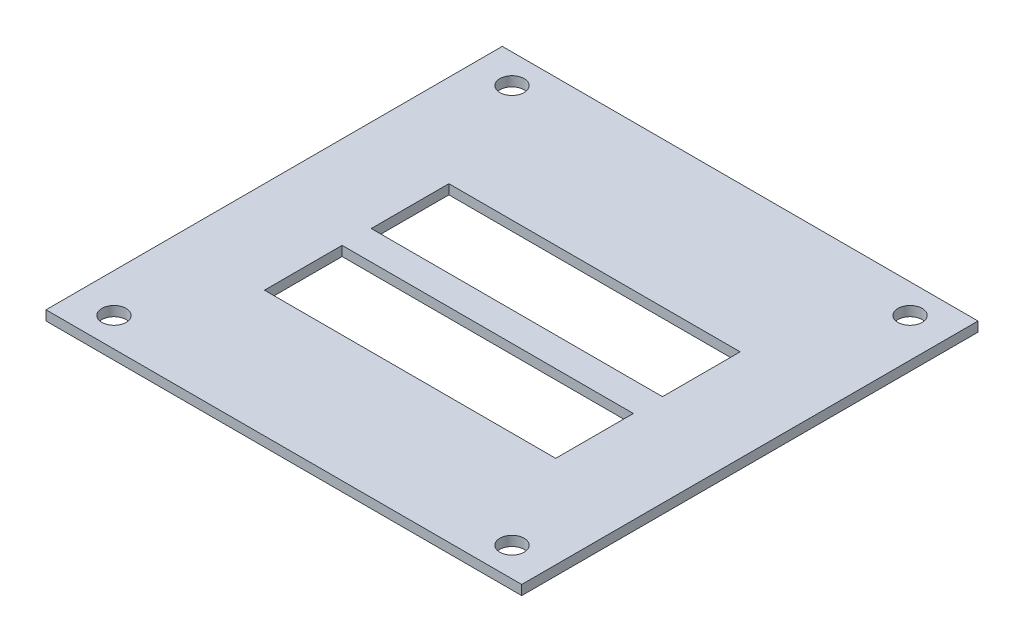
from build123d import *

# Parameters (mm, degrees)
CROQUIS1_W                                 = 49
CROQUIS1_H                                 = 47
SALIENTE_EXTRUIR1_DEPTH                    = 1
PERFORADOR_PARA_ROSCAR_PARA_MACHO_DE_ROS_D = 2.5
CORTAR_EXTRUIR1_REACH                      = 69.904
CROQUIS5_W                                 = 30
CROQUIS5_H                                 = 8


with BuildPart() as part:
    # Croquis1 → Saliente-Extruir1 (new body)
    with BuildSketch(Plane(origin=(0, 0, 0), x_dir=(1, 0, 0), z_dir=(0, 1, 0))):
        with Locations((24.5, 23.5)):
            Rectangle(CROQUIS1_W, CROQUIS1_H)
    extrude(amount=SALIENTE_EXTRUIR1_DEPTH)

    # Perforador para roscar para macho de roscar para M31 (through all)
    with Locations(Plane(origin=(4, 1, -44), x_dir=(0, 0, 1), z_dir=(0, 1, 0))):
        with Locations((0, 0), (41, 0), (41, 41), (0, 41)):
            Hole(PERFORADOR_PARA_ROSCAR_PARA_MACHO_DE_ROS_D / 2)

    # Croquis5 → Cortar-Extruir1 (cut, up to next)
    with BuildSketch(Plane(origin=(0, 1, 0), x_dir=(1, 0, 0), z_dir=(0, 1, 0)), mode=Mode.PRIVATE) as cortar_extruir1_sk1:
        with Locations((24.5, 17)):
            Rectangle(CROQUIS5_W, CROQUIS5_H)
    cortar_extruir1_tool1 = extrude(cortar_extruir1_sk1.sketch, amount=-CORTAR_EXTRUIR1_REACH, mode=Mode.PRIVATE) & part.part
    # Croquis5 → Cortar-Extruir1 (cut, up to next)
    with BuildSketch(Plane(origin=(0, 1, 0), x_dir=(1, 0, 0), z_dir=(0, 1, 0)), mode=Mode.PRIVATE) as cortar_extruir1_sk2:
        with Locations((24.5, 28)):
            Rectangle(CROQUIS5_W, CROQUIS5_H)
    cortar_extruir1_tool2 = extrude(cortar_extruir1_sk2.sketch, amount=-CORTAR_EXTRUIR1_REACH, mode=Mode.PRIVATE) & part.part
    add(cortar_extruir1_tool1.solids().sort_by_distance((24.5, 1, -17))[0], mode=Mode.SUBTRACT)
    add(cortar_extruir1_tool2.solids().sort_by_distance((24.5, 1, -28))[0], mode=Mode.SUBTRACT)


solid = part.part
